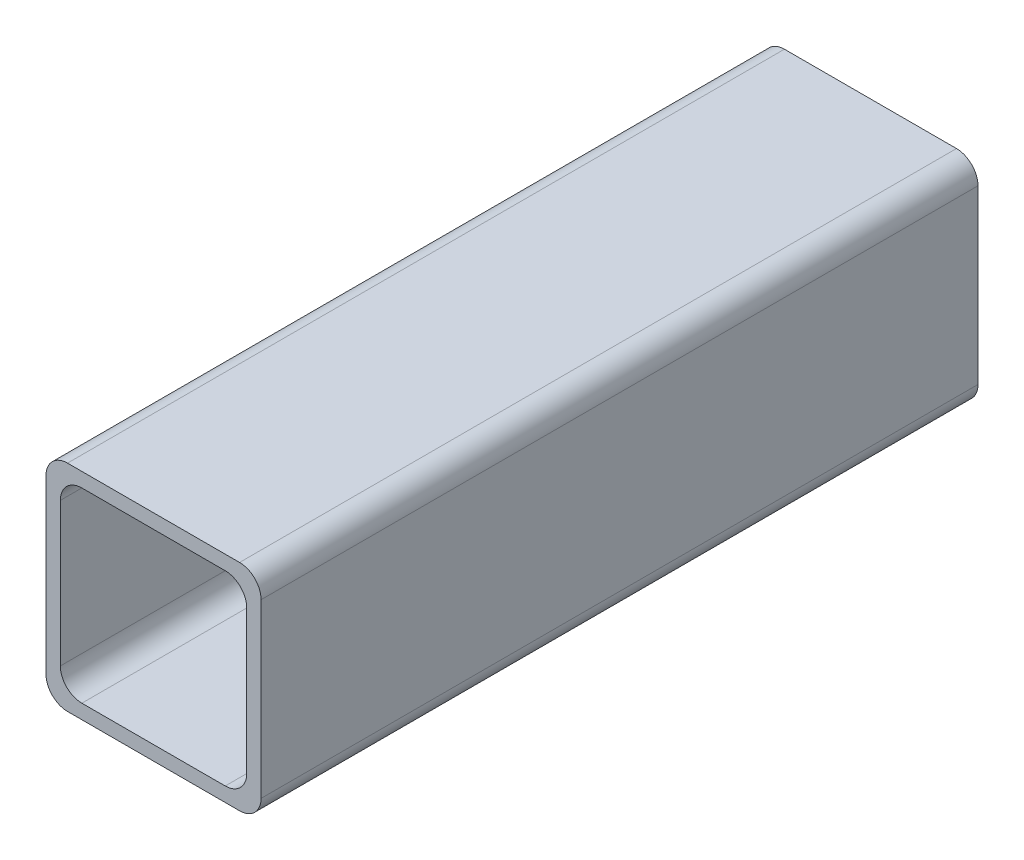
from build123d import *

# Parameters (mm, degrees)
BOSS_EXTRU_1_DEPTH = 100


with BuildPart() as part:
    # Esquisse1 → Boss.-Extru.1 (new body)
    with BuildSketch(Plane.XY):
        with BuildLine():
            Line((-12, -15), (12, -15))
            ThreePointArc((12, -15), (14.121320344, -14.121320344), (15, -12))
            Line((15, -12), (15, 12))
            ThreePointArc((15, 12), (14.121320344, 14.121320344), (12, 15))
            Line((12, 15), (-12, 15))
            ThreePointArc((-12, 15), (-14.121320344, 14.121320344), (-15, 12))
            Line((-15, 12), (-15, -12))
            ThreePointArc((-15, -12), (-14.121320344, -14.121320344), (-12, -15))
        make_face()
        with BuildLine():
            Line((-10, -13), (10, -13))
            ThreePointArc((10, -13), (12.121320344, -12.121320344), (13, -10))
            Line((13, -10), (13, 10))
            ThreePointArc((13, 10), (12.121320344, 12.121320344), (10, 13))
            Line((10, 13), (-10, 13))
            ThreePointArc((-10, 13), (-12.121320344, 12.121320344), (-13, 10))
            Line((-13, 10), (-13, -10))
            ThreePointArc((-13, -10), (-12.121320344, -12.121320344), (-10, -13))
        make_face(mode=Mode.SUBTRACT)
    extrude(amount=-BOSS_EXTRU_1_DEPTH)


solid = part.part
